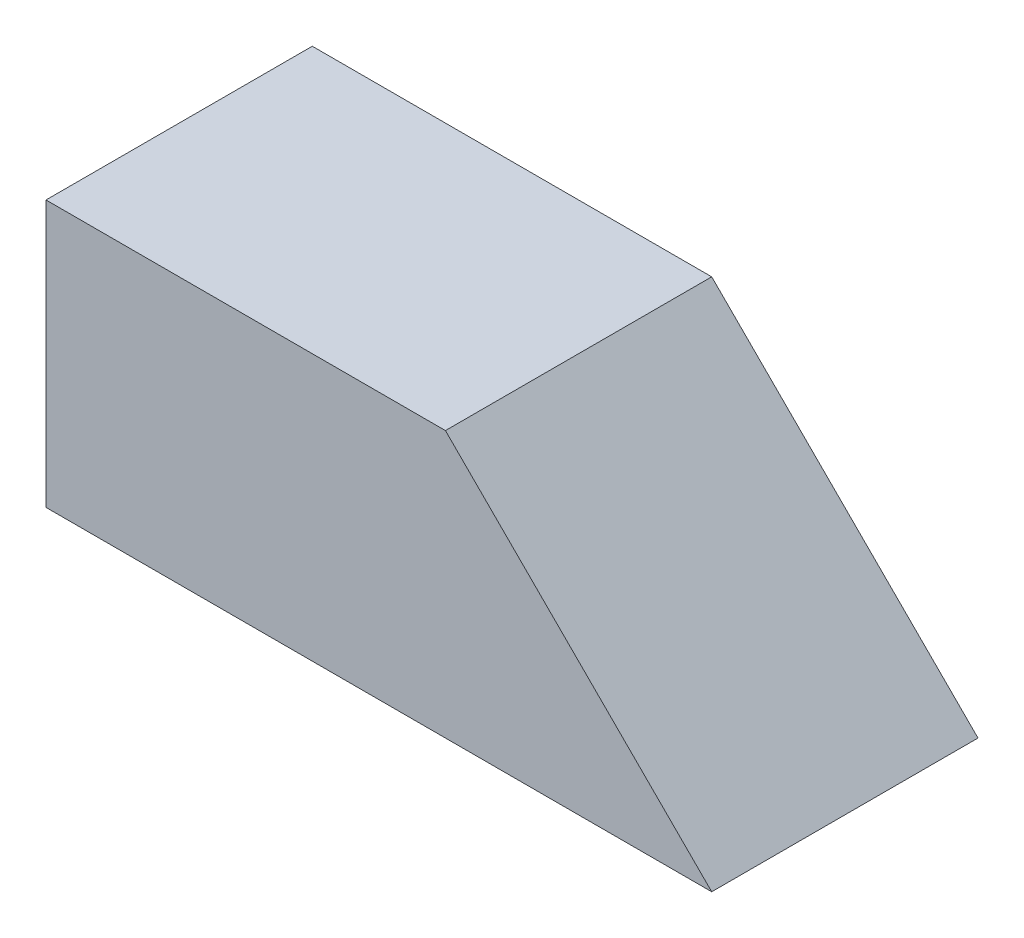
from build123d import *

# Parameters (mm, degrees)
BOSS_EXTRUDE3_DEPTH = 20


with BuildPart() as part:
    # Sketch2 → Boss-Extrude3 (new body)
    with BuildSketch(Plane.XY):
        Polygon((-113.732958232, 21.444043321), (-113.732958232, 1.444043321), (-63.732958232, 1.444043321), (-83.732958232, 21.444043321), align=None)
    extrude(amount=BOSS_EXTRUDE3_DEPTH)


solid = part.part
